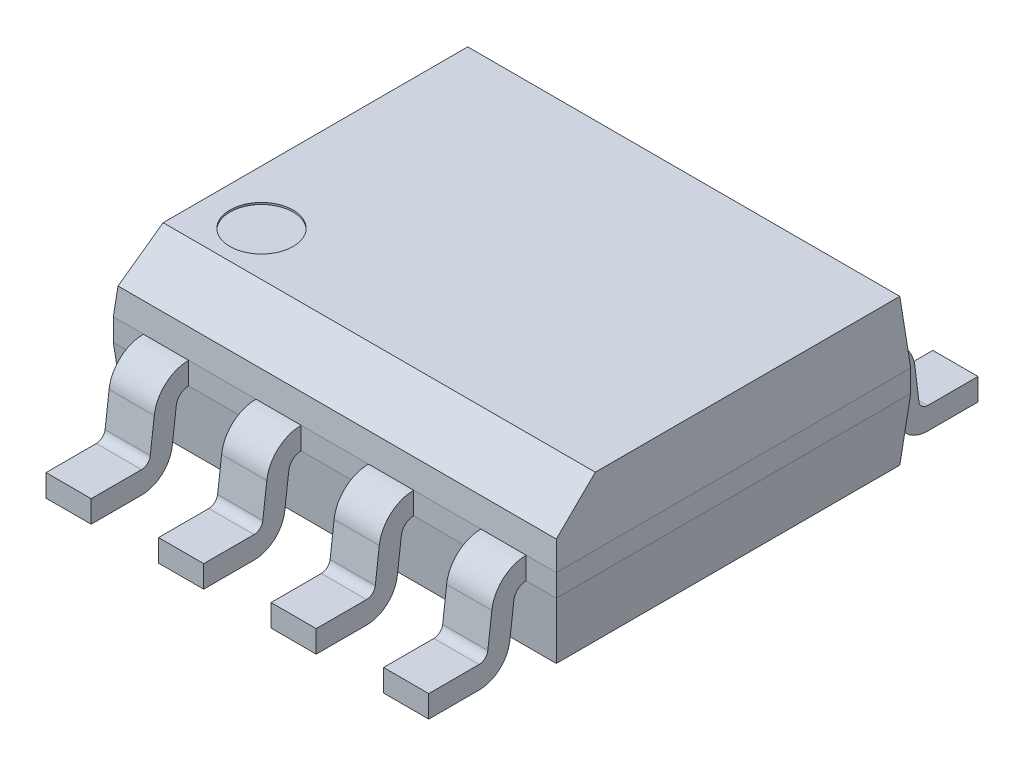
from build123d import *

# Parameters (mm, degrees)
BOSS_EXTRUDE1_DEPTH      = 0.125
BOSS_EXTRUDE1_DEPTH_BACK = 0.125
SKETCH1_W                = 5
SKETCH1_H                = 4
SKETCH2_W                = 5
SKETCH2_H                = 4
BOSS_EXTRUDE2_DEPTH      = 0.7
BOSS_EXTRUDE2_TAPER      = 5
SKETCH3_W                = 5
SKETCH3_H                = 4
BOSS_EXTRUDE3_DEPTH      = 0.7
BOSS_EXTRUDE3_TAPER      = 5
CHAMFER1_SIZE            = 0.4
CHAMFER1_SIZE2           = 0.440025147
BOSS_EXTRUDE4_START      = 0.38
BOSS_EXTRUDE4_DEPTH      = 0.51
LPATTERN1_COUNT          = 2
LPATTERN1_PITCH          = 1.27
LPATTERN1_COL_COUNT      = 3
LPATTERN1_COL_PITCH      = 1.27
SKETCH6_R                = 0.356697025
CUT_EXTRUDE1_DEPTH       = 0.02


with BuildPart() as part:
    # Sketch1 → Boss-Extrude1 (new, two sides: drawn at the far end of the back side and taken through both)
    with BuildSketch(Plane(origin=(0, 0.92, 0), x_dir=(1, 0, 0), z_dir=(0, 1, 0)).offset(-BOSS_EXTRUDE1_DEPTH_BACK)):
        Rectangle(SKETCH1_W, SKETCH1_H)
    extrude(amount=BOSS_EXTRUDE1_DEPTH + BOSS_EXTRUDE1_DEPTH_BACK)

    # Sketch2 → Boss-Extrude2 (add)
    with BuildSketch(Plane(origin=(0, 1.045, 0), x_dir=(1, 0, 0), z_dir=(0, 1, 0))):
        Rectangle(SKETCH2_W, SKETCH2_H)
    extrude(amount=BOSS_EXTRUDE2_DEPTH, taper=BOSS_EXTRUDE2_TAPER)

    # Sketch3 → Boss-Extrude3 (add)
    with BuildSketch(Plane.XZ.offset(-0.795)):
        Rectangle(SKETCH3_W, SKETCH3_H)
    extrude(amount=BOSS_EXTRUDE3_DEPTH, taper=BOSS_EXTRUDE3_TAPER)

    # Chamfer1
    chamfer1_edges = [part.edges().sort_by_distance(p)[0] for p in [
        (0, 1.745, 1.938757936),
    ]]
    chamfer1_side = [part.faces().sort_by_distance(p)[0] for p in [
        (0, 1.393553299, 1.969505538),
    ]]
    chamfer(chamfer1_edges, length=CHAMFER1_SIZE, length2=CHAMFER1_SIZE2, reference=chamfer1_side[0])

    # Sketch5 → Boss-Extrude4 (add)
    with BuildSketch(Plane(origin=(0, 0, 0), x_dir=(0, 0, -1), z_dir=(1, 0, 0)).offset(BOSS_EXTRUDE4_START)):
        with BuildLine():
            Line((2.43285762, 0.329963507), (2.38761047, 0.698105953))
            ThreePointArc((2.38761047, 0.698105953), (2.260085254, 0.945612561), (2, 1.045))
            Line((2, 1.045), (2, 0.795))
            ThreePointArc((2, 0.795), (2.091746463, 0.76074775), (2.138599743, 0.674751237))
            Line((2.138599743, 0.674751237), (2.184724748, 0.299466331))
            ThreePointArc((2.184724748, 0.299466331), (2.300209515, 0.080013931), (2.532110769, -0.007837622))
            Line((2.532110769, -0.007837622), (3.099630301, -0.007837622))
            Line((3.099630301, -0.007837622), (3.099630301, 0.242162378))
            Line((3.099630301, 0.242162378), (2.532110769, 0.242162378))
            ThreePointArc((2.532110769, 0.242162378), (2.465853268, 0.267262822), (2.43285762, 0.329963507))
        make_face()
        with BuildLine():
            ThreePointArc((-2.138599743, 0.674751237), (-2.091746463, 0.76074775), (-2, 0.795))
            Line((-2, 0.795), (-2, 1.045))
            ThreePointArc((-2, 1.045), (-2.260085254, 0.945612561), (-2.38761047, 0.698105953))
            Line((-2.38761047, 0.698105953), (-2.43285762, 0.329963507))
            ThreePointArc((-2.43285762, 0.329963507), (-2.465853268, 0.267262822), (-2.532110769, 0.242162378))
            Line((-2.532110769, 0.242162378), (-3.099630301, 0.242162378))
            Line((-3.099630301, 0.242162378), (-3.099630301, -0.007837622))
            Line((-3.099630301, -0.007837622), (-2.532110769, -0.007837622))
            ThreePointArc((-2.532110769, -0.007837622), (-2.300209515, 0.080013931), (-2.184724748, 0.299466331))
            Line((-2.184724748, 0.299466331), (-2.138599743, 0.674751237))
        make_face()
    boss_extrude4 = extrude(amount=BOSS_EXTRUDE4_DEPTH)

    # LPattern1: Boss-Extrude4 ×2
    with Locations(*[(i * LPATTERN1_PITCH, 0, 0) for i in range(1, LPATTERN1_COUNT)]):
        add(boss_extrude4)

    # LPattern1 col: Boss-Extrude4 ×3
    with Locations(*[(-i * LPATTERN1_COL_PITCH, 0, 0) for i in range(1, LPATTERN1_COL_COUNT)]):
        add(boss_extrude4)

    # Sketch6 → Cut-Extrude1 (cut)
    with BuildSketch(Plane(origin=(0, 1.745, 0), x_dir=(1, 0, 0), z_dir=(0, 1, 0))):
        with Locations(Location((-1.829466097, -0.997890598, 0), (0, 0, 270))):
            Circle(SKETCH6_R)
    extrude(amount=-CUT_EXTRUDE1_DEPTH, mode=Mode.SUBTRACT)


solid = part.part
